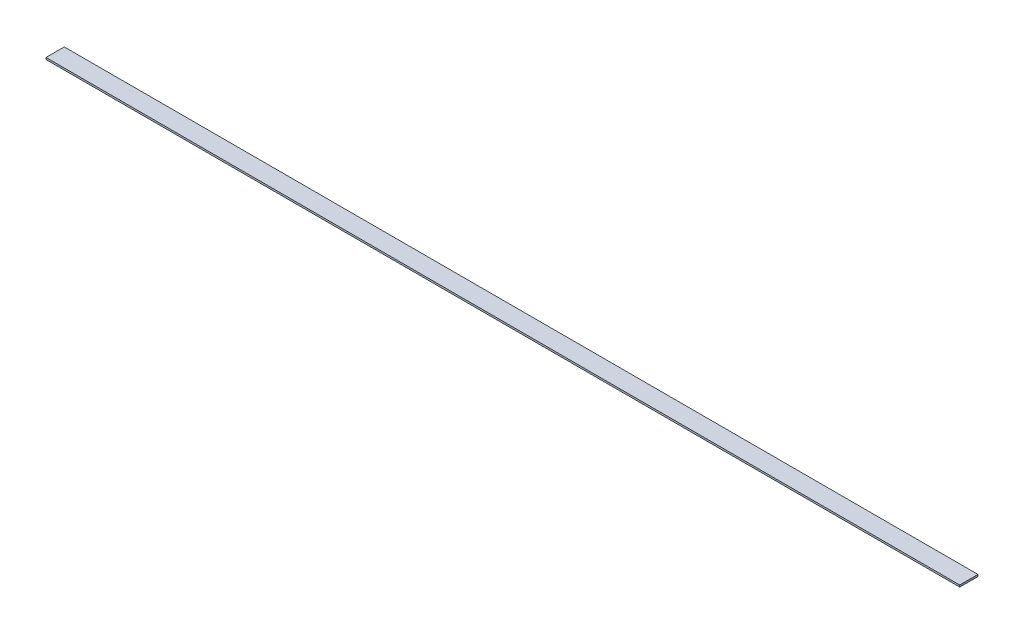
from build123d import *

# Parameters (mm, degrees)
SKETCH1_W           = 50000
SKETCH1_H           = 100
BOSS_EXTRUDE1_DEPTH = 1000


with BuildPart() as part:
    # Sketch1 → Boss-Extrude1 (new body)
    with BuildSketch(Plane.XY):
        with Locations((25000, 50)):
            Rectangle(SKETCH1_W, SKETCH1_H)
    extrude(amount=BOSS_EXTRUDE1_DEPTH)


solid = part.part
